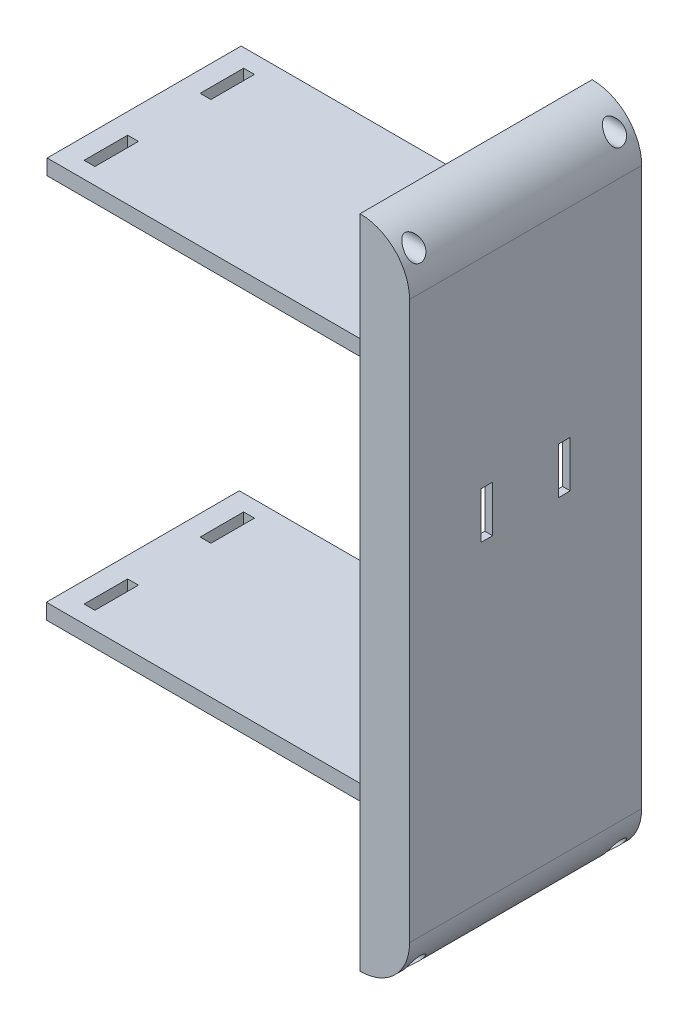
from build123d import *

# Parameters (mm, degrees)
BOSS_EXTRUDE1_DEPTH     = 19.05
CUT_EXTRUDE4_DEPTH      = 0.508
CUT_EXTRUDE4_DEPTH_BACK = 6.858
SKETCH4_W               = 31.54
SKETCH4_H               = 60.54
SKETCH4_3_W             = 1.905
SKETCH4_3_H             = 7.62
CUT_EXTRUDE5_DEPTH      = 34.798
SKETCH5_W               = 31.679207877
SKETCH5_H               = 2.54
SKETCH5_W_2             = 31.841170495
BOSS_EXTRUDE2_DEPTH     = 54.61
SKETCH6_W               = 1.77119272
SKETCH6_H               = 7.149457174
CUT_EXTRUDE6_DEPTH      = 90.782
SKETCH4_5_R             = 1.524
CUT_EXTRUDE7_DEPTH      = 90.782


with BuildPart() as part:
    # Sketch2 → Boss-Extrude1 (new, symmetric)
    with BuildSketch(Plane.XY):
        with BuildLine():
            Line((8.128, -45.72), (8.128, 45.72))
            ThreePointArc((8.128, 45.72), (5.747363917, 51.467363917), (0, 53.848))
            Line((0, 53.848), (0, -53.848))
            ThreePointArc((0, -53.848), (5.747363917, -51.467363917), (8.128, -45.72))
        make_face()
    extrude(amount=BOSS_EXTRUDE1_DEPTH, both=True)

    # Sketch4 → Cut-Extrude4 (cut, two sides: drawn at the far end of the back side and taken through both)
    with BuildSketch(Plane.ZY.offset(-CUT_EXTRUDE4_DEPTH_BACK)):
        with Locations((0.025266364, 0.022760685)):
            Rectangle(SKETCH4_W, SKETCH4_H)
    extrude(amount=CUT_EXTRUDE4_DEPTH + CUT_EXTRUDE4_DEPTH_BACK, mode=Mode.SUBTRACT)

    # Sketch4<3> → Cut-Extrude5 (cut)
    with BuildSketch(Plane.ZY):
        with Locations((-6.375, 9.13)):
            Rectangle(SKETCH4_3_W, SKETCH4_3_H)
        with Locations((6.375, 9.13)):
            Rectangle(SKETCH4_3_W, SKETCH4_3_H)
    extrude(amount=-CUT_EXTRUDE5_DEPTH, mode=Mode.SUBTRACT)

    # Sketch5 → Boss-Extrude2 (add)
    with BuildSketch(Plane.ZY):
        with Locations((0.094870302, -31.517239315)):
            Rectangle(SKETCH5_W, SKETCH5_H)
        with Locations((-0.125318883, 31.562760685)):
            Rectangle(SKETCH5_W_2, SKETCH5_H)
    extrude(amount=BOSS_EXTRUDE2_DEPTH)

    # Sketch6 → Cut-Extrude6 (cut)
    with BuildSketch(Plane(origin=(0, 32.832760685, 0), x_dir=(1, 0, 0), z_dir=(0, 1, 0))):
        with Locations((-50.36366337, 9.522864257)):
            Rectangle(SKETCH6_W, SKETCH6_H)
        with Locations((-50.36366337, -9.522864257)):
            Rectangle(SKETCH6_W, SKETCH6_H)
    extrude(amount=-CUT_EXTRUDE6_DEPTH, mode=Mode.SUBTRACT)

    # Sketch4<5> → Cut-Extrude7 (cut)
    with BuildSketch(Plane.ZY):
        with Locations((-16.466357327, -50.756314804)):
            Circle(SKETCH4_5_R)
        with Locations((16.466357327, -50.756314804)):
            Circle(SKETCH4_5_R)
        with Locations((16.466357327, 50.756314804)):
            Circle(SKETCH4_5_R)
        with Locations((-16.466357327, 50.756314804)):
            Circle(SKETCH4_5_R)
    extrude(amount=-CUT_EXTRUDE7_DEPTH, mode=Mode.SUBTRACT)


solid = part.part
